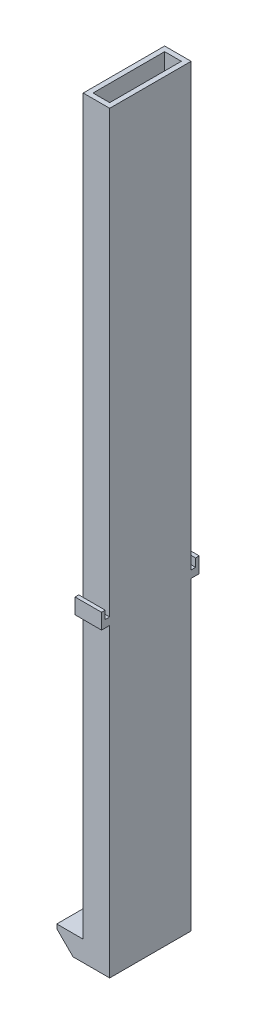
from build123d import *

# Parameters (mm, degrees)
SKETCH1_W           = 6.5
SKETCH1_H           = 92.5
BOSS_EXTRUDE1_DEPTH = 10
SKETCH2_W           = 3.25
SKETCH2_H           = 90
CUT_EXTRUDE1_DEPTH  = 10
CHAMFER1_SIZE       = 2
BOSS_EXTRUDE2_DEPTH = 3.25
SKETCH6_W           = 2.05
SKETCH6_H           = 8.8
CUT_EXTRUDE2_DEPTH  = 80


with BuildPart() as part:
    # Sketch1 → Boss-Extrude1 (new body)
    with BuildSketch(Plane.XY):
        Rectangle(SKETCH1_W, SKETCH1_H)
    extrude(amount=BOSS_EXTRUDE1_DEPTH)

    # Sketch2 → Cut-Extrude1 (cut)
    with BuildSketch(Plane.XY.offset(10)):
        with Locations((-1.625, 1.25)):
            Rectangle(SKETCH2_W, SKETCH2_H)
    extrude(amount=-CUT_EXTRUDE1_DEPTH, mode=Mode.SUBTRACT)

    # Chamfer1
    chamfer1_edges = [part.edges().sort_by_distance(p)[0] for p in [
        (-3.25, -46.25, 5),
    ]]
    chamfer(chamfer1_edges, length=CHAMFER1_SIZE)

    # Sketch4 → Boss-Extrude2 (add)
    with BuildSketch(Plane.ZY):
        Polygon((10, -8.75), (11, -8.75), (11, -6.85), (10.55, -6.85), (10.55, -7.85), (10, -7.85), align=None)
    boss_extrude2 = extrude(amount=-BOSS_EXTRUDE2_DEPTH)

    # Mirror1: Boss-Extrude2 across plane
    add(boss_extrude2.mirror(Plane.XY.offset(5)))

    # Sketch6 → Cut-Extrude2 (cut)
    with BuildSketch(Plane(origin=(0, 46.25, 0), x_dir=(1, 0, 0), z_dir=(0, 1, 0))):
        with Locations((1.625, -5)):
            Rectangle(SKETCH6_W, SKETCH6_H)
    extrude(amount=-CUT_EXTRUDE2_DEPTH, mode=Mode.SUBTRACT)


solid = part.part
